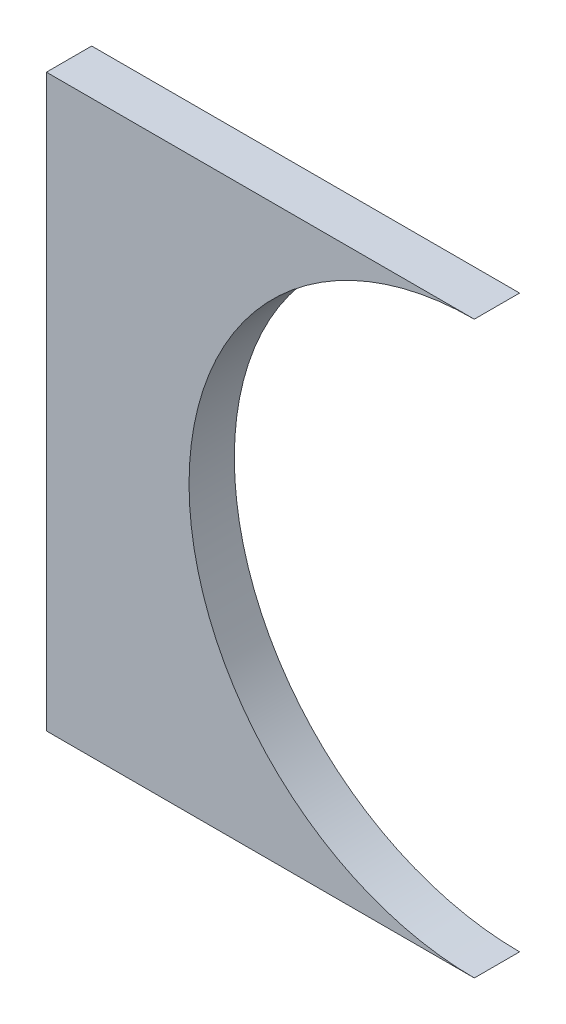
from build123d import *

# Parameters (mm, degrees)
BOSS_EXTRUDE1_DEPTH = 3.175


with BuildPart() as part:
    # Sketch1 → Boss-Extrude1 (new body)
    with BuildSketch(Plane.XY):
        with BuildLine():
            Line((0, 0), (30, 0))
            ThreePointArc((30, 0), (10, 20), (30, 40))
            Line((30, 40), (0, 40))
            Line((0, 40), (0, 0))
        make_face()
    extrude(amount=BOSS_EXTRUDE1_DEPTH)


solid = part.part
